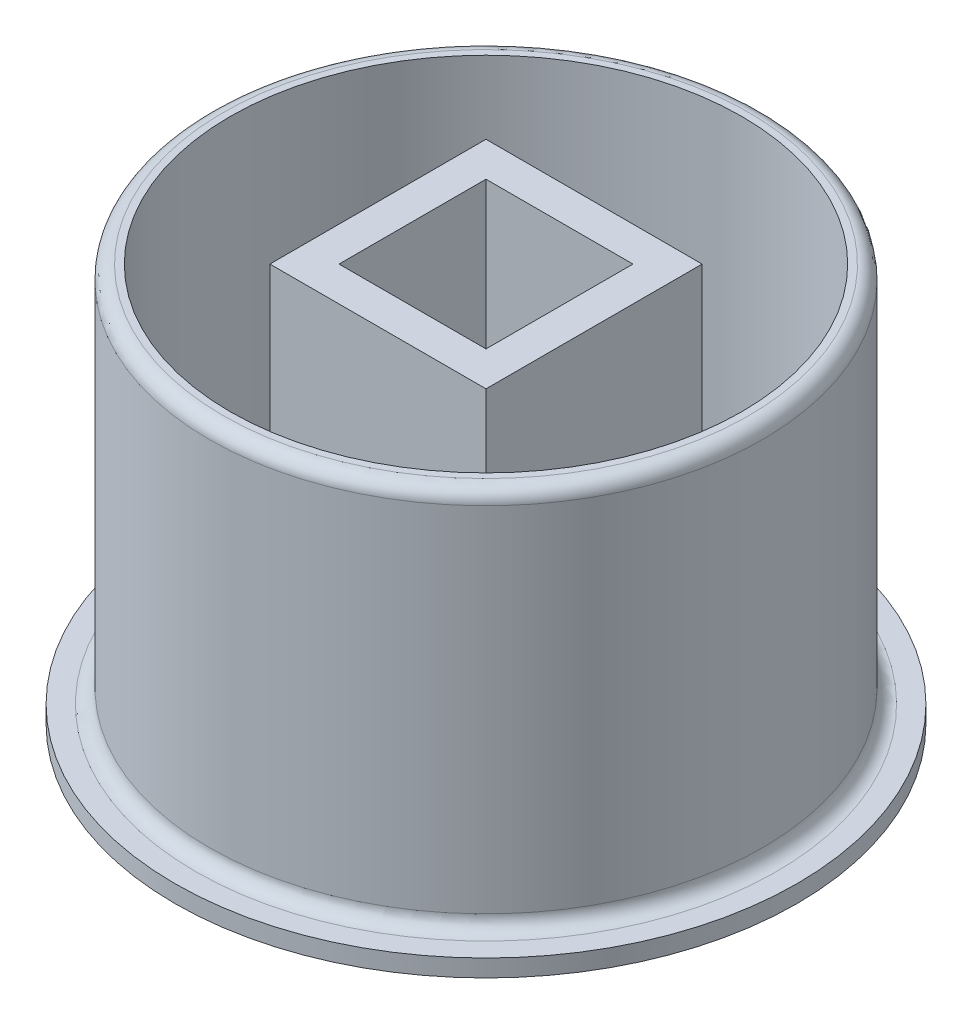
from build123d import *

# Parameters (mm, degrees)
SKETCH1_R           = 57.15
BOSS_EXTRUDE1_DEPTH = 3.175
SKETCH2_R           = 50.8
BOSS_EXTRUDE2_DEPTH = 70
SHELL3_T            = -3.81
BOSS_EXTRUDE3_REACH = 111.027
SKETCH3_W           = 39.7
SKETCH3_H           = 39.7
SKETCH3_W_2         = 27
SKETCH3_H_2         = 27
FILLET2_R           = 2.54
SKETCH4_W           = 27
SKETCH4_H           = 27
BOSS_EXTRUDE5_DEPTH = 40


with BuildPart() as part:
    # Sketch1 → Boss-Extrude1 (new body)
    with BuildSketch(Plane(origin=(0, 0, 0), x_dir=(1, 0, 0), z_dir=(0, 1, 0))):
        with Locations(Location((0, 0, 0), (0, 0, 270))):
            Circle(SKETCH1_R)
    extrude(amount=BOSS_EXTRUDE1_DEPTH)

    # Sketch2 → Boss-Extrude2 (add)
    with BuildSketch(Plane(origin=(0, 3.175, 0), x_dir=(1, 0, 0), z_dir=(0, 1, 0))):
        with Locations(Location((0, 0, 0), (0, 0, 270))):
            Circle(SKETCH2_R)
    extrude(amount=BOSS_EXTRUDE2_DEPTH)

    # Shell3
    shell3_openings = [part.faces().sort_by_distance(p)[0] for p in [
        (0, 73.175, 0),
    ]]
    offset(amount=SHELL3_T, openings=shell3_openings, kind=Kind.INTERSECTION)

    # Sketch3 → Boss-Extrude3 (add, up to next)
    with BuildSketch(Plane(origin=(0, 73.175, 0), x_dir=(1, 0, 0), z_dir=(0, 1, 0)), mode=Mode.PRIVATE) as boss_extrude3_sk1:
        Rectangle(SKETCH3_W, SKETCH3_H)
        Rectangle(SKETCH3_W_2, SKETCH3_H_2, mode=Mode.SUBTRACT)
    boss_extrude3_tool1 = extrude(boss_extrude3_sk1.sketch, amount=-BOSS_EXTRUDE3_REACH, mode=Mode.PRIVATE) - part.part
    add(boss_extrude3_tool1.solids().sort_by_distance((0, 73.175, -19.288557))[0])

    # Fillet2
    fillet2_edges = [part.edges().sort_by_distance(p)[0] for p in [
        (0, 3.175, -50.8),
        (0, 73.175, -50.8),
    ]]
    fillet(fillet2_edges, radius=FILLET2_R)

    # Sketch4 → Boss-Extrude5 (add)
    with BuildSketch(Plane(origin=(0, 3.81, 0), x_dir=(1, 0, 0), z_dir=(0, 1, 0))):
        Rectangle(SKETCH4_W, SKETCH4_H)
    extrude(amount=BOSS_EXTRUDE5_DEPTH)


solid = part.part
